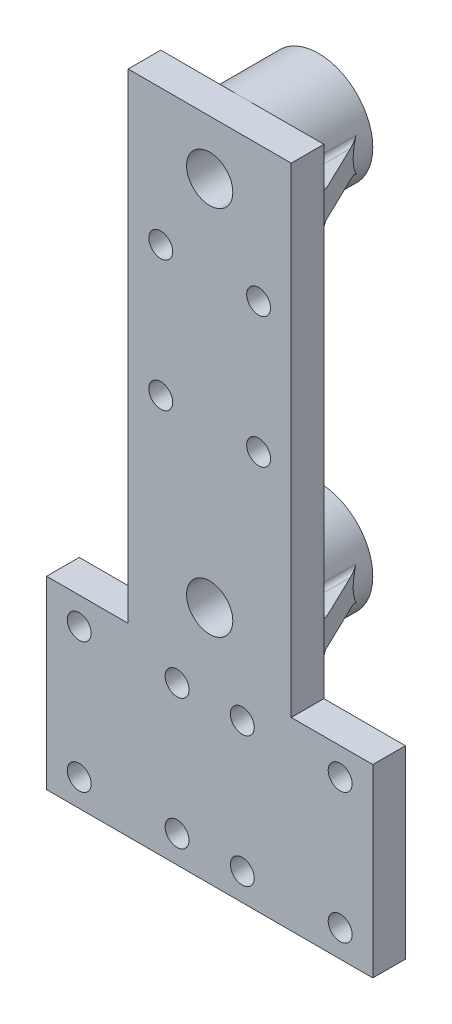
from build123d import *

# Parameters (mm, degrees)
SKETCH1_R                 = 2.2
BOSS_EXTRUDE1_DEPTH       = 6
SKETCH4_W                 = 30
SKETCH4_H                 = 6
BOSS_EXTRUDE3_DEPTH       = 20
SKETCH5_R                 = 10
SKETCH5_R_2               = 4.25
BOSS_EXTRUDE4_DEPTH       = 20
CUT_EXTRUDE1_START        = -20
SKETCH7_R                 = 4.25
CUT_EXTRUDE1_DEPTH        = 20
RIB1_REACH                = 118.934
SKETCH8_WALL_W            = 247.402128672
SKETCH8_WALL_H            = 5
CIRPATTERN2_COUNT         = 2
CIRPATTERN2_ANGLE         = 180
LPATTERN3_COUNT           = 2
LPATTERN3_PITCH           = 68.3
LPATTERN3_COPY_1_REACH    = 118.934
LPATTERN3_COPY_1_SKETCH_W = 247.402128672
LPATTERN3_COPY_1_SKETCH_H = 5
FILLET4_R                 = 1
CUT_EXTRUDE2_START        = -20
SKETCH9_R                 = 4.25
CUT_EXTRUDE2_DEPTH        = 20


with BuildPart() as part:
    # Sketch1 → Boss-Extrude1 (new body)
    with BuildSketch(Plane.XY):
        Polygon((-15, 51.15), (15, 51.15), (15, -17.15), (30, -17.15), (30, -51.15), (15, -51.15), (-15, -51.15), (-30, -51.15), (-30, -17.15), (-15, -17.15), align=None)
        with Locations((9, 46.15)):
            Circle(SKETCH1_R, mode=Mode.SUBTRACT)
        with Locations((-9, 46.15)):
            Circle(SKETCH1_R, mode=Mode.SUBTRACT)
        with Locations((-9, 22.15)):
            Circle(SKETCH1_R, mode=Mode.SUBTRACT)
        with Locations((9, 22.15)):
            Circle(SKETCH1_R, mode=Mode.SUBTRACT)
        with Locations((-6, -22.15)):
            Circle(SKETCH1_R, mode=Mode.SUBTRACT)
        with Locations((-24, -22.15)):
            Circle(SKETCH1_R, mode=Mode.SUBTRACT)
        with Locations((-24, -46.15)):
            Circle(SKETCH1_R, mode=Mode.SUBTRACT)
        with Locations((-6, -46.15)):
            Circle(SKETCH1_R, mode=Mode.SUBTRACT)
        with Locations((6, -22.15)):
            Circle(SKETCH1_R, mode=Mode.SUBTRACT)
        with Locations((24, -22.15)):
            Circle(SKETCH1_R, mode=Mode.SUBTRACT)
        with Locations((6, -46.15)):
            Circle(SKETCH1_R, mode=Mode.SUBTRACT)
        with Locations((24, -46.15)):
            Circle(SKETCH1_R, mode=Mode.SUBTRACT)
    extrude(amount=BOSS_EXTRUDE1_DEPTH)

    # Sketch4 → Boss-Extrude3 (add)
    with BuildSketch(Plane(origin=(0, 51.15, 0), x_dir=(1, 0, 0), z_dir=(0, 1, 0))):
        with Locations((0, -3)):
            Rectangle(SKETCH4_W, SKETCH4_H)
    extrude(amount=BOSS_EXTRUDE3_DEPTH)

    # Sketch5 → Boss-Extrude4 (add)
    with BuildSketch(Plane.XY.offset(6)):
        with Locations((0, 61.15)):
            Circle(SKETCH5_R)
        with Locations((0, 61.15)):
            Circle(SKETCH5_R_2, mode=Mode.SUBTRACT)
    boss_extrude4 = extrude(amount=-BOSS_EXTRUDE4_DEPTH)

    # Sketch7 → Cut-Extrude1 (cut)
    with BuildSketch(Plane(origin=(0, 0, 0), x_dir=(-1, 0, 0), z_dir=(0, 0, -1)).offset(CUT_EXTRUDE1_START)):
        with Locations(Location((0, 61.15, 0), (0, 0, 180))):
            Circle(SKETCH7_R)
    extrude(amount=CUT_EXTRUDE1_DEPTH, mode=Mode.SUBTRACT)

    # Sketch8 wall → Rib1 (add, up to next)
    with BuildSketch(Plane(origin=(12.5, 61, -5.196726493), x_dir=(-0.433516092302, 0, -0.901145824889), z_dir=(-0.901145824889, 0, 0.433516092302)), mode=Mode.PRIVATE) as rib1_sk1:
        Rectangle(SKETCH8_WALL_W, SKETCH8_WALL_H)
    rib1_tool1 = extrude(rib1_sk1.sketch, amount=RIB1_REACH, mode=Mode.PRIVATE) - part.part
    rib1 = rib1_tool1.solids().sort_by_distance((12.5, 61, -5.196726493))[0]
    add(rib1)

    # CirPattern2: Rib1 ×2 about axis
    cirpattern2_axis = Axis((0, 61.15, -14), (0, 0, 1))
    for i in range(1, CIRPATTERN2_COUNT):
        add(rib1.rotate(cirpattern2_axis, i * CIRPATTERN2_ANGLE / (CIRPATTERN2_COUNT - 1)))

    # LPattern3: Boss-Extrude4, Rib1 ×2
    with Locations(*[(0, -i * LPATTERN3_PITCH, 0) for i in range(1, LPATTERN3_COUNT)]):
        add(boss_extrude4)
        add(rib1)

    # LPattern3 copy 1 sketch → LPattern3 copy 1 (add, up to next)
    with BuildSketch(Plane(origin=(-12.5, -7, -5.196726493), x_dir=(0.433516092302, 3.0272266927212608e-15, -0.901145824889), z_dir=(0.901145824889, 6.292667662352691e-15, 0.433516092302)), mode=Mode.PRIVATE) as lpattern3_copy_1_sk1:
        Rectangle(LPATTERN3_COPY_1_SKETCH_W, LPATTERN3_COPY_1_SKETCH_H)
    lpattern3_copy_1_tool1 = extrude(lpattern3_copy_1_sk1.sketch, amount=LPATTERN3_COPY_1_REACH, mode=Mode.PRIVATE) - part.part
    add(lpattern3_copy_1_tool1.solids().sort_by_distance((-12.5, -7, -5.196726493))[0])

    # Fillet4
    fillet4_edges = [part.edges().sort_by_distance(p)[0] for p in [
        (12.359976852, 63.5, 0),
        (9.719953704, 63.5, -5.487791295),
        (9.64248412, 58.5, -5.568308943),
        (12.32124206, 58.5, 0),
        (-9.64248412, 63.8, -5.568308943),
        (-12.32124206, 63.8, 0),
        (-12.359976852, 58.8, 0),
        (-9.719953704, 58.8, -5.487791295),
        (12.359976852, -4.8, 0),
        (9.64248412, -9.8, -5.568308943),
        (9.719953704, -4.8, -5.487791295),
        (12.32124206, -9.8, 0),
        (-9.64248412, -4.5, -5.568308943),
        (-12.359976852, -9.5, 0),
        (-9.719953704, -9.5, -5.487791295),
        (-12.32124206, -4.5, 0),
    ]]
    fillet(fillet4_edges, radius=FILLET4_R)

    # Sketch9 → Cut-Extrude2 (cut)
    with BuildSketch(Plane(origin=(0, 0, 0), x_dir=(-1, 0, 0), z_dir=(0, 0, -1)).offset(CUT_EXTRUDE2_START)):
        with Locations(Location((0, -7.15, 0), (0, 0, 180))):
            Circle(SKETCH9_R)
    extrude(amount=CUT_EXTRUDE2_DEPTH, mode=Mode.SUBTRACT)


solid = part.part
